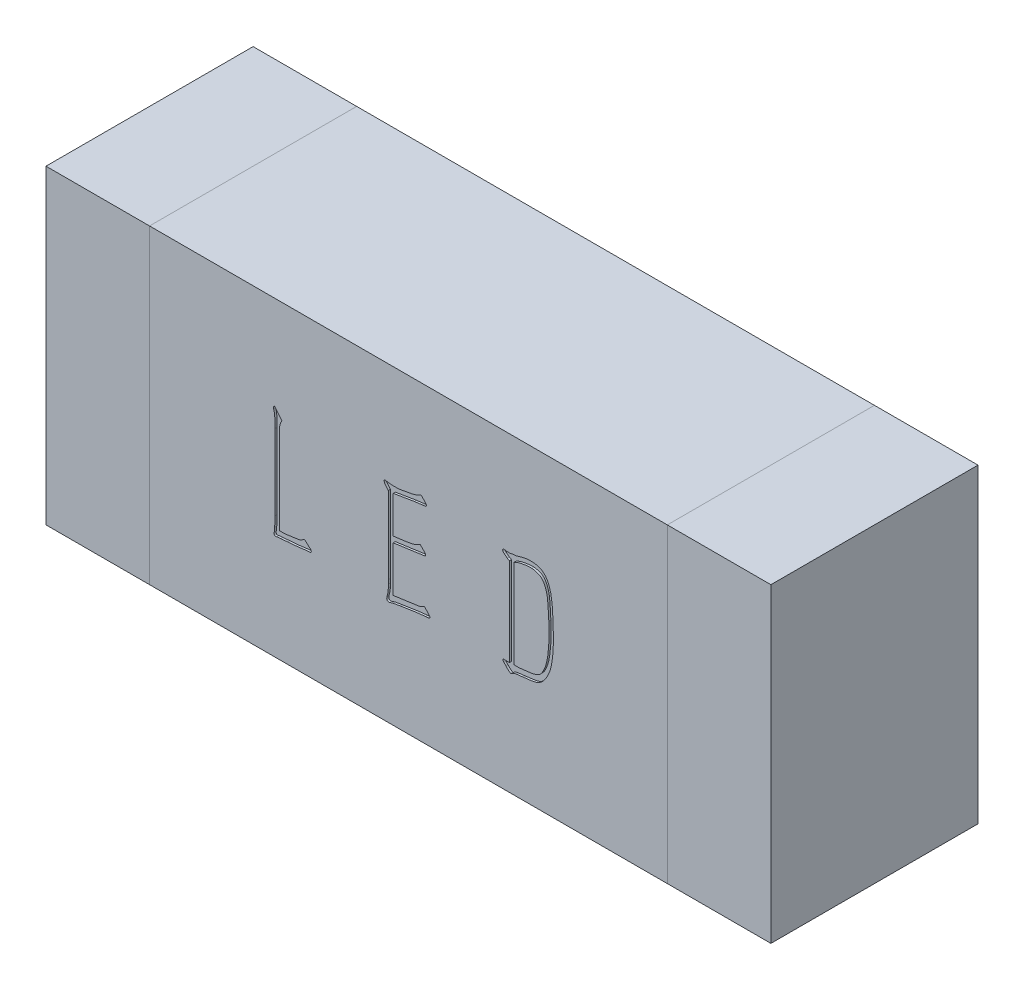
from build123d import *

# Parameters (mm, degrees)
SKETCH_1_W          = 2.5
SKETCH_1_H          = 1.5
EXTRUDE_1_DEPTH     = 1
SKETCH_2_W          = 0.5
SKETCH_2_H          = 1.5
EXTRUDE_2_DEPTH     = 1
EXTRUDE_2_2_DEPTH   = 1
CUT_EXTRUDE_1_DEPTH = 0.01


with BuildPart() as part:
    # 草图1 → 凸台-拉伸1 (new body)
    with BuildSketch(Plane.XY):
        Rectangle(SKETCH_1_W, SKETCH_1_H)
    extrude(amount=EXTRUDE_1_DEPTH)

    # 草图4 → 切除-拉伸1 (cut)
    # profile 1 of 3: a face of its own
    with BuildSketch(Plane.XY.offset(1)):
        with BuildLine():
            Line((-0.652338465, 0.292451565), (-0.646686981, 0.298944759))
            Line((-0.646686981, 0.298944759), (-0.610974415, 0.254334112))
            add(Edge.make_bspline(
                [(-0.610974415, 0.254334112), (-0.612006577, 0.252405464), (-0.614045299, 0.248596005), (-0.617414747, 0.242727128), (-0.620056211, 0.235381677), (-0.621764866, 0.226142642), (-0.622972876, 0.215125486), (-0.623068807, 0.207242271), (-0.623119093, 0.203110028)],
                knots=[0, 0, 0, 0, 0.736410598, 1.454555069, 2.274010016, 3.348139226, 4.609940921, 6, 6, 6, 6], degree=3))
            Line((-0.623119093, 0.203110028), (-0.623119093, -0.210770956))
            add(Edge.make_bspline(
                [(-0.623119093, -0.210770956), (-0.619791691, -0.21080651), (-0.613696975, -0.210871634), (-0.605525903, -0.210478756), (-0.599142578, -0.210513845), (-0.593927616, -0.21007894), (-0.588367616, -0.209334609), (-0.581157325, -0.208379148), (-0.571522684, -0.207211018), (-0.560304951, -0.205604519), (-0.548922877, -0.203913053), (-0.538975878, -0.20239064), (-0.531243838, -0.201032209), (-0.523970595, -0.199773714), (-0.516828273, -0.197295153), (-0.510560653, -0.192722991), (-0.506530935, -0.188084355), (-0.503394238, -0.186903503), (-0.502273541, -0.186481601)],
                knots=[0, 0, 0, 0, 1.271684107, 2.329311289, 3.126176351, 3.710204741, 4.32783396, 5.270448411, 6.49050515, 8.03759688, 9.602040843, 10.889228832, 11.884182716, 12.602334394, 13.712376462, 14.732953672, 15.547302315, 16, 16, 16, 16], degree=3))
            add(Edge.make_bspline(
                [(-0.502273541, -0.186481601), (-0.501749522, -0.186878732), (-0.500227353, -0.188032317), (-0.497185393, -0.190653048), (-0.492141981, -0.194809196), (-0.486026565, -0.200734653), (-0.479749714, -0.206541775), (-0.474756773, -0.211156364), (-0.471170658, -0.214448033), (-0.469782041, -0.217856444), (-0.469202757, -0.220610487), (-0.469036052, -0.222232639), (-0.468965861, -0.222915633)],
                knots=[0, 0, 0, 0, 0.390394386, 1.134016561, 2.38360509, 4.269889804, 6.18981564, 7.453157385, 8.329021544, 9.032311711, 9.592562279, 10, 10, 10, 10], degree=3))
            add(Edge.make_bspline(
                [(-0.468965861, -0.222915633), (-0.469301489, -0.223688874), (-0.469976288, -0.225243519), (-0.472360495, -0.226751459), (-0.475441335, -0.227552281), (-0.480801088, -0.227461866), (-0.488480384, -0.227208072), (-0.498441404, -0.228753737), (-0.509132961, -0.230236704), (-0.517619799, -0.231563764), (-0.524067649, -0.232500179), (-0.528769773, -0.232914809), (-0.534691638, -0.233579532), (-0.541876415, -0.234112075), (-0.550291196, -0.234858434), (-0.559951507, -0.235692732), (-0.570847808, -0.236684229), (-0.578547684, -0.237274854), (-0.582596753, -0.237585442)],
                knots=[0, 0, 0, 0, 0.341365878, 0.68633572, 1.116730632, 1.647491765, 2.890856209, 4.29325764, 5.800779701, 7.359923239, 7.845242571, 8.495183841, 9.311733456, 10.309872826, 11.474601469, 12.805924266, 14.320358265, 16, 16, 16, 16], degree=3))
            Line((-0.582596753, -0.237585442), (-0.616625899, -0.240832039))
            Line((-0.616625899, -0.240832039), (-0.635384014, -0.242395215))
            add(Edge.make_bspline(
                [(-0.635384014, -0.242395215), (-0.637336646, -0.243031445), (-0.640501404, -0.244062624), (-0.645168496, -0.243398305), (-0.647194409, -0.240696381), (-0.648763994, -0.237732764), (-0.648645504, -0.233112351), (-0.647775712, -0.226702128), (-0.646650885, -0.217878714), (-0.646132249, -0.211212821), (-0.645845271, -0.207524359)],
                knots=[0, 0, 0, 0, 1.058270145, 1.715207142, 2.242218181, 2.723015089, 3.427046488, 4.550153686, 6.091084828, 8, 8, 8, 8], degree=3))
            Line((-0.645845271, -0.207524359), (-0.644282095, -0.159667116))
            Line((-0.644282095, -0.159667116), (-0.644282095, 0.205635159))
            add(Edge.make_bspline(
                [(-0.644282095, 0.205635159), (-0.644265069, 0.21016453), (-0.644234482, 0.218301587), (-0.644412399, 0.229082266), (-0.644444801, 0.23710258), (-0.644809735, 0.244275674), (-0.645246411, 0.25189446), (-0.645906037, 0.2613417), (-0.647414127, 0.2723509), (-0.649584349, 0.280049975), (-0.650775288, 0.28427495)],
                knots=[0, 0, 0, 0, 1.372323329, 2.465391677, 3.267017655, 3.801925377, 4.641299591, 5.579257235, 6.671583216, 8, 8, 8, 8], degree=3))
            Line((-0.650775288, 0.28427495), (-0.652338465, 0.292451565))
        make_face()
    # profile 2 of 3: a face of its own
    with BuildSketch(Plane.XY.offset(1)):
        with BuildLine():
            Line((-0.07348226, 0.220184723), (-0.07348226, 0.041621893))
            Line((-0.07348226, 0.041621893), (-0.005303725, 0.050519973))
            add(Edge.make_bspline(
                [(-0.005303725, 0.050519973), (-0.002857166, 0.05091102), (0.002570211, 0.051778508), (0.010966243, 0.05335037), (0.019348845, 0.055276671), (0.026873806, 0.057303235), (0.033327326, 0.059612394), (0.039215272, 0.061801593), (0.044527105, 0.064356446), (0.047589552, 0.066550637), (0.049046712, 0.067594668)],
                knots=[0, 0, 0, 0, 1.0349619, 2.295929578, 3.567192849, 4.627442236, 5.548769194, 6.428698295, 7.252349857, 8, 8, 8, 8], degree=3))
            Line((0.049046712, 0.067594668), (0.056381616, 0.071682975))
            Line((0.056381616, 0.071682975), (0.079949505, 0.048115086))
            add(Edge.make_bspline(
                [(0.079949505, 0.048115086), (0.081035545, 0.046750027), (0.082840371, 0.044481514), (0.083853072, 0.040682781), (0.082986638, 0.037798623), (0.08128393, 0.035730825), (0.078769966, 0.034399845), (0.076880845, 0.034326549), (0.075861198, 0.034286988)],
                knots=[0, 0, 0, 0, 1.598367029, 2.656232682, 3.46306406, 4.276633186, 5.069817383, 6, 6, 6, 6], degree=3))
            Line((0.075861198, 0.034286988), (-0.07348226, 0.013244231))
            Line((-0.07348226, 0.013244231), (-0.07348226, -0.206682649))
            Line((-0.07348226, -0.206682649), (0.047483536, -0.189728198))
            add(Edge.make_bspline(
                [(0.047483536, -0.189728198), (0.049373167, -0.189354534), (0.053191312, -0.188599517), (0.058909617, -0.186939817), (0.064559807, -0.184447039), (0.068295652, -0.182532499), (0.070209714, -0.181551584)],
                knots=[0, 0, 0, 0, 0.952294954, 1.924184826, 2.936455269, 4, 4, 4, 4], degree=3))
            Line((0.070209714, -0.181551584), (0.077424374, -0.177463277))
            Line((0.077424374, -0.177463277), (0.100150552, -0.202714586))
            add(Edge.make_bspline(
                [(0.100150552, -0.202714586), (0.101296928, -0.204059939), (0.103189427, -0.20628092), (0.103688228, -0.210195262), (0.102685584, -0.212678243), (0.1014898, -0.214739221), (0.098706609, -0.215598927), (0.096658219, -0.215661031), (0.095340779, -0.215700974)],
                knots=[0, 0, 0, 0, 1.609002555, 2.656228529, 3.444229916, 4.084037918, 4.767732536, 6, 6, 6, 6], degree=3))
            Line((0.095340779, -0.215700974), (0.083196102, -0.21642244))
            add(Edge.make_bspline(
                [(0.083196102, -0.21642244), (0.079788023, -0.216731311), (0.072443352, -0.217396952), (0.060737533, -0.218722342), (0.047563745, -0.220470766), (0.032959803, -0.222330259), (0.016893472, -0.2246659), (-0.000587784, -0.227276505), (-0.019530178, -0.23034644), (-0.032638566, -0.232419454), (-0.039453115, -0.233497134)],
                knots=[0, 0, 0, 0, 0.663087027, 1.429003413, 2.282528104, 3.23817949, 4.281637937, 5.428377517, 6.663111914, 8, 8, 8, 8], degree=3))
            Line((-0.039453115, -0.233497134), (-0.076728857, -0.239990328))
            add(Edge.make_bspline(
                [(-0.076728857, -0.239990328), (-0.079633517, -0.241118311), (-0.084801139, -0.243125082), (-0.091922798, -0.245210013), (-0.098019475, -0.244907843), (-0.1029613, -0.241920481), (-0.1052782, -0.23574298), (-0.104710012, -0.231254446), (-0.104385053, -0.228687361)],
                knots=[0, 0, 0, 0, 1.380317655, 2.455695842, 3.256886563, 4.014496814, 4.864449804, 6, 6, 6, 6], degree=3))
            add(Edge.make_bspline(
                [(-0.104385053, -0.228687361), (-0.104248876, -0.227759535), (-0.103861803, -0.225122268), (-0.102082263, -0.220559898), (-0.100489222, -0.214582514), (-0.09883102, -0.207389062), (-0.09784762, -0.198201377), (-0.09734375, -0.191252256), (-0.097050149, -0.187203067)],
                knots=[0, 0, 0, 0, 0.398372487, 1.132340191, 2.07227747, 3.032898756, 4.271097258, 6, 6, 6, 6], degree=3))
            Line((-0.097050149, -0.187203067), (-0.097050149, -0.171811793))
            add(Edge.make_bspline(
                [(-0.097050149, -0.171811793), (-0.096917504, -0.169567767), (-0.09667359, -0.165441355), (-0.096513028, -0.159824879), (-0.096157164, -0.155301851), (-0.096192795, -0.152653305), (-0.096208439, -0.151490501)],
                knots=[0, 0, 0, 0, 1.325956836, 2.438225671, 3.314326982, 4, 4, 4, 4], degree=3))
            Line((-0.096208439, -0.151490501), (-0.097050149, 0.220184723))
            add(Edge.make_bspline(
                [(-0.097050149, 0.220184723), (-0.098639725, 0.222079836), (-0.101835689, 0.225890108), (-0.106720821, 0.231227902), (-0.110614117, 0.236388603), (-0.114098728, 0.240505585), (-0.116098803, 0.244391679), (-0.117212923, 0.248082839), (-0.116991254, 0.251267408), (-0.117511278, 0.254399052), (-0.114258864, 0.256664603), (-0.111700744, 0.256199721), (-0.110036536, 0.255897289)],
                knots=[0, 0, 0, 0, 1.53483591, 3.085905438, 4.484103556, 5.548538687, 6.41610315, 7.18824125, 7.885014218, 8.432694789, 8.98037536, 10, 10, 10, 10], degree=3))
            Line((-0.110036536, 0.255897289), (-0.094645262, 0.253492402))
            add(Edge.make_bspline(
                [(-0.094645262, 0.253492402), (-0.091240485, 0.253025106), (-0.085282163, 0.252207344), (-0.07743046, 0.251451839), (-0.071578268, 0.251139266), (-0.068349557, 0.251610441), (-0.066989066, 0.251808981)],
                knots=[0, 0, 0, 0, 1.482629705, 2.594585164, 3.407796403, 4, 4, 4, 4], degree=3))
            Line((-0.066989066, 0.251808981), (-0.06458418, 0.251808981))
            add(Edge.make_bspline(
                [(-0.06458418, 0.251808981), (-0.061498246, 0.251849734), (-0.055686123, 0.251926489), (-0.047368515, 0.252026046), (-0.039883142, 0.252860862), (-0.035198066, 0.253857838), (-0.032959921, 0.254334112)],
                knots=[0, 0, 0, 0, 1.164559704, 2.193360016, 3.136935425, 4, 4, 4, 4], degree=3))
            Line((-0.032959921, 0.254334112), (-0.001215418, 0.259985596))
            add(Edge.make_bspline(
                [(-0.001215418, 0.259985596), (0.001913425, 0.260450076), (0.00746073, 0.261273581), (0.015215731, 0.262648116), (0.022358166, 0.264343486), (0.029628286, 0.266487352), (0.036926115, 0.268695008), (0.043486238, 0.271099034), (0.048840171, 0.273488746), (0.051828368, 0.275388064), (0.053135019, 0.27621858)],
                knots=[0, 0, 0, 0, 1.329594741, 2.357314772, 3.309480275, 4.413369338, 5.543056356, 6.5132362, 7.349881783, 8, 8, 8, 8], degree=3))
            Line((0.053135019, 0.27621858), (0.060469923, 0.281028354))
            Line((0.060469923, 0.281028354), (0.083917568, 0.256738999))
            add(Edge.make_bspline(
                [(0.083917568, 0.256738999), (0.084769559, 0.255335776), (0.086158645, 0.253047958), (0.087417294, 0.249728239), (0.08681548, 0.24706773), (0.085195426, 0.245167368), (0.082776334, 0.243884335), (0.080928421, 0.243798227), (0.079949505, 0.243752611)],
                knots=[0, 0, 0, 0, 1.627163788, 2.652929776, 3.381477164, 4.196017905, 5.044355687, 6, 6, 6, 6], degree=3))
            Line((0.079949505, 0.243752611), (0.066963117, 0.242069191))
            add(Edge.make_bspline(
                [(0.066963117, 0.242069191), (0.064157089, 0.241710979), (0.058905004, 0.241040509), (0.051532226, 0.240061475), (0.04519541, 0.239250043), (0.039916149, 0.238478457), (0.035659855, 0.238017238), (0.032452678, 0.237663344), (0.030249686, 0.237408635), (0.029126323, 0.237298664), (0.02872542, 0.237259417)],
                knots=[0, 0, 0, 0, 1.761538881, 3.297099284, 4.631434889, 5.739811667, 6.619076803, 7.297127464, 7.749161238, 8, 8, 8, 8], degree=3))
            Line((0.02872542, 0.237259417), (-0.07348226, 0.220184723))
        make_face()
    # profile 3 of 3: a face of its own
    with BuildSketch(Plane.XY.offset(1)):
        with BuildLine():
            add(Edge.make_bspline(
                [(0.487818272, 0.218621546), (0.485701997, 0.219564703), (0.482038242, 0.221197522), (0.478662572, 0.223359755), (0.477236771, 0.22427303)],
                knots=[0, 0, 0, 0, 1.155249011, 2, 2, 2, 2], degree=3))
            Line((0.477236771, 0.22427303), (0.462687207, 0.236417707))
            add(Edge.make_bspline(
                [(0.462687207, 0.236417707), (0.461264263, 0.237470788), (0.458684592, 0.23937993), (0.455949895, 0.24294769), (0.45493159, 0.246546305), (0.455185851, 0.249754544), (0.456347876, 0.252538701), (0.457857251, 0.253742575), (0.4585989, 0.254334112)],
                knots=[0, 0, 0, 0, 1.447871613, 2.624862772, 3.613765279, 4.438196654, 5.232590026, 6, 6, 6, 6], degree=3))
            Line((0.4585989, 0.254334112), (0.473268708, 0.251808981))
            Line((0.473268708, 0.251808981), (0.490223159, 0.251808981))
            add(Edge.make_bspline(
                [(0.490223159, 0.251808981), (0.490503932, 0.251847792), (0.491672589, 0.252009333), (0.494273743, 0.252520516), (0.498591993, 0.253374679), (0.502045563, 0.253981624), (0.504051257, 0.254334112)],
                knots=[0, 0, 0, 0, 0.241932977, 1.006992227, 2.261782692, 4, 4, 4, 4], degree=3))
            Line((0.504051257, 0.254334112), (0.521125952, 0.255897289))
            Line((0.521125952, 0.255897289), (0.5519085, 0.264795369))
            add(Edge.make_bspline(
                [(0.5519085, 0.264795369), (0.554466431, 0.265431391), (0.55982638, 0.266764128), (0.568392291, 0.268136852), (0.577735784, 0.269261576), (0.584250794, 0.269567256), (0.587621066, 0.269725387)],
                knots=[0, 0, 0, 0, 0.875268756, 1.834059148, 2.879539399, 4, 4, 4, 4], degree=3))
            add(Edge.make_bspline(
                [(0.587621066, 0.269725387), (0.591030182, 0.269689531), (0.59753606, 0.269621106), (0.606877014, 0.268824885), (0.615424213, 0.267869694), (0.625568283, 0.265594542), (0.63729937, 0.261650914), (0.649709984, 0.253777839), (0.660565073, 0.243463317), (0.6681978, 0.232944673), (0.6735611, 0.223256677), (0.677413676, 0.214951845), (0.680860326, 0.20569311), (0.683965864, 0.195519578), (0.686851155, 0.184495686), (0.689380404, 0.172499059), (0.691522263, 0.159537676), (0.693828722, 0.141183446), (0.696074376, 0.118143785), (0.697189132, 0.090726325), (0.698138511, 0.063305401), (0.698946262, 0.040335181), (0.699841421, 0.022266742), (0.700164501, 0.009918299), (0.700425016, -0.001063899), (0.700497009, -0.007958738), (0.700530492, -0.011165368)],
                knots=[0, 0, 0, 0, 0.718585689, 1.371332375, 1.976198466, 2.529891817, 3.561749994, 4.56781114, 5.602123862, 6.702587104, 7.292809697, 7.935632291, 8.631030849, 9.374196065, 10.177765977, 11.033092299, 11.958456765, 12.947006156, 14.933404235, 16.837287687, 18.73165533, 20.719239715, 21.683649529, 22.54608654, 23.323818374, 24, 24, 24, 24], degree=3))
            add(Edge.make_bspline(
                [(0.700530492, -0.011165368), (0.700371697, -0.014732666), (0.700034439, -0.022309124), (0.699466042, -0.034337966), (0.69856242, -0.047679669), (0.697382316, -0.067030511), (0.695111851, -0.091654265), (0.690683242, -0.11582327), (0.686321883, -0.134527352), (0.681950668, -0.147795504), (0.676888143, -0.160544482), (0.671083176, -0.172512469), (0.664724122, -0.183530213), (0.658187682, -0.193373722), (0.651391493, -0.201946205), (0.644319352, -0.209187623), (0.636838966, -0.215249331), (0.628828803, -0.220097963), (0.620250823, -0.223843218), (0.610813943, -0.226537466), (0.600042776, -0.22850992), (0.587352886, -0.230374532), (0.572450792, -0.232457062), (0.561731654, -0.233682971), (0.555996807, -0.234338845)],
                knots=[0, 0, 0, 0, 0.774403953, 1.64472916, 2.611501509, 3.674251025, 5.849538744, 7.968932488, 8.997760875, 10.012092789, 10.995102175, 11.970898344, 12.893807862, 13.752068917, 14.531287561, 15.26274097, 15.942861734, 16.613698282, 17.287120385, 17.96651865, 18.737058996, 19.660295931, 20.748234995, 22, 22, 22, 22], degree=3))
            Line((0.555996807, -0.234338845), (0.520284241, -0.238427152))
            add(Edge.make_bspline(
                [(0.520284241, -0.238427152), (0.516864764, -0.239011124), (0.51062176, -0.240077293), (0.503856389, -0.24344051), (0.499840532, -0.246202694), (0.497685127, -0.247672026), (0.496205937, -0.248566065), (0.495396054, -0.248814042), (0.495153176, -0.248888409)],
                knots=[0, 0, 0, 0, 2.258427549, 4.123254342, 4.879658115, 5.446960944, 5.834147501, 6, 6, 6, 6], degree=3))
            add(Edge.make_bspline(
                [(0.495153176, -0.248888409), (0.494457227, -0.248904076), (0.492701081, -0.24894361), (0.49001157, -0.247077601), (0.486397032, -0.2447417), (0.482489064, -0.241185399), (0.478589167, -0.237479035), (0.475170492, -0.234240881), (0.472652247, -0.231623523), (0.471299952, -0.230054409), (0.470743577, -0.229408827)],
                knots=[0, 0, 0, 0, 0.515294809, 1.300285127, 2.366249425, 3.803798064, 5.259385994, 6.436385369, 7.356681581, 8, 8, 8, 8], degree=3))
            Line((0.470743577, -0.229408827), (0.461003787, -0.218947571))
            add(Edge.make_bspline(
                [(0.461003787, -0.218947571), (0.459572845, -0.21742395), (0.457368388, -0.215076714), (0.455251819, -0.211137232), (0.456338688, -0.208771742), (0.457332986, -0.206818317), (0.460194028, -0.206212417), (0.462233265, -0.206499957), (0.463528918, -0.206682649)],
                knots=[0, 0, 0, 0, 1.90810625, 2.939560931, 3.619271678, 4.135931338, 4.815642084, 6, 6, 6, 6], degree=3))
            Line((0.463528918, -0.206682649), (0.474831885, -0.206682649))
            Line((0.474831885, -0.206682649), (0.487818272, -0.206682649))
            Line((0.487818272, -0.206682649), (0.487818272, 0.218621546))
        make_face()
        with BuildLine():
            add(Edge.make_bspline(
                [(0.510544451, -0.205119473), (0.513189231, -0.205279161), (0.518115784, -0.205576619), (0.524972438, -0.205419366), (0.530714983, -0.20560747), (0.534153525, -0.2052692), (0.535675516, -0.205119473)],
                knots=[0, 0, 0, 0, 1.263335509, 2.353272607, 3.271114373, 4, 4, 4, 4], degree=3))
            Line((0.535675516, -0.205119473), (0.571388082, -0.201031165))
            add(Edge.make_bspline(
                [(0.571388082, -0.201031165), (0.576041438, -0.200548268), (0.584974545, -0.199621242), (0.59774223, -0.197683908), (0.60921371, -0.194850349), (0.619673554, -0.191625183), (0.629146261, -0.186884794), (0.637434753, -0.18006805), (0.644768006, -0.171349858), (0.650717076, -0.160836258), (0.655916314, -0.149594835), (0.660723674, -0.138399912), (0.664259636, -0.127243089), (0.668212657, -0.112467258), (0.671870761, -0.09299852), (0.675227484, -0.067955027), (0.677536707, -0.040306194), (0.678300135, -0.009687441), (0.678389157, 0.024148008), (0.678005541, 0.047834777), (0.677804314, 0.060259764)],
                knots=[0, 0, 0, 0, 0.792675974, 1.52171018, 2.185483906, 2.793222177, 3.373317832, 3.96724032, 4.598502022, 5.292637146, 6.0064898, 6.697595424, 7.354735785, 7.987274644, 9.288454635, 10.706973044, 12.26743299, 13.986389814, 15.894645254, 18, 18, 18, 18], degree=3))
            add(Edge.make_bspline(
                [(0.677804314, 0.060259764), (0.6775295, 0.064909574), (0.676960843, 0.074531162), (0.675964861, 0.089436763), (0.674997515, 0.105349116), (0.674118206, 0.121872076), (0.673038343, 0.138126646), (0.67137529, 0.153175088), (0.669242643, 0.166586766), (0.666611748, 0.178481909), (0.663438895, 0.189129788), (0.659789672, 0.198806589), (0.655284163, 0.207448095), (0.650384449, 0.215279662), (0.644708636, 0.222065396), (0.638356014, 0.22777163), (0.631183199, 0.232237582), (0.621142284, 0.236173827), (0.609333797, 0.239574857), (0.599983717, 0.240799466), (0.595797681, 0.241347725)],
                knots=[0, 0, 0, 0, 1.134903754, 2.348391475, 3.639854006, 5.019058801, 6.380025606, 7.608394198, 8.706568192, 9.687444568, 10.574206556, 11.412083321, 12.202637834, 12.944909566, 13.658888821, 14.35068326, 15.017343718, 15.704712398, 16.972398388, 18, 18, 18, 18], degree=3))
            add(Edge.make_bspline(
                [(0.595797681, 0.241347725), (0.592950739, 0.241440455), (0.587010073, 0.241633954), (0.577666263, 0.2408546), (0.567493338, 0.239895982), (0.556985218, 0.238009041), (0.546959397, 0.236198908), (0.538311594, 0.234469831), (0.531487351, 0.232685747), (0.527613206, 0.231346227), (0.525935725, 0.230766224)],
                knots=[0, 0, 0, 0, 0.962606207, 2.0086543, 3.167397159, 4.417684765, 5.616878664, 6.613902928, 7.399828632, 8, 8, 8, 8], degree=3))
            Line((0.525935725, 0.230766224), (0.510544451, 0.22427303))
            Line((0.510544451, 0.22427303), (0.510544451, -0.205119473))
        make_face(mode=Mode.SUBTRACT)
    extrude(amount=-CUT_EXTRUDE_1_DEPTH, mode=Mode.SUBTRACT)


with BuildPart() as body_2:
    # 草图2 → 凸台-拉伸2 (new body)
    with BuildSketch(Plane(origin=(0, 0, 0), x_dir=(-1, 0, 0), z_dir=(0, 0, -1))):
        with Locations((1.5, 0)):
            Rectangle(SKETCH_2_W, SKETCH_2_H)
    extrude(amount=-EXTRUDE_2_DEPTH)


with BuildPart() as body_3:
    # 草图2 → Extrude 2 2 (new body)
    with BuildSketch(Plane(origin=(0, 0, 0), x_dir=(-1, 0, 0), z_dir=(0, 0, -1))):
        with Locations((-1.5, 0)):
            Rectangle(SKETCH_2_W, SKETCH_2_H)
    extrude(amount=-EXTRUDE_2_2_DEPTH)


solid = Compound([part.part, body_2.part, body_3.part])
